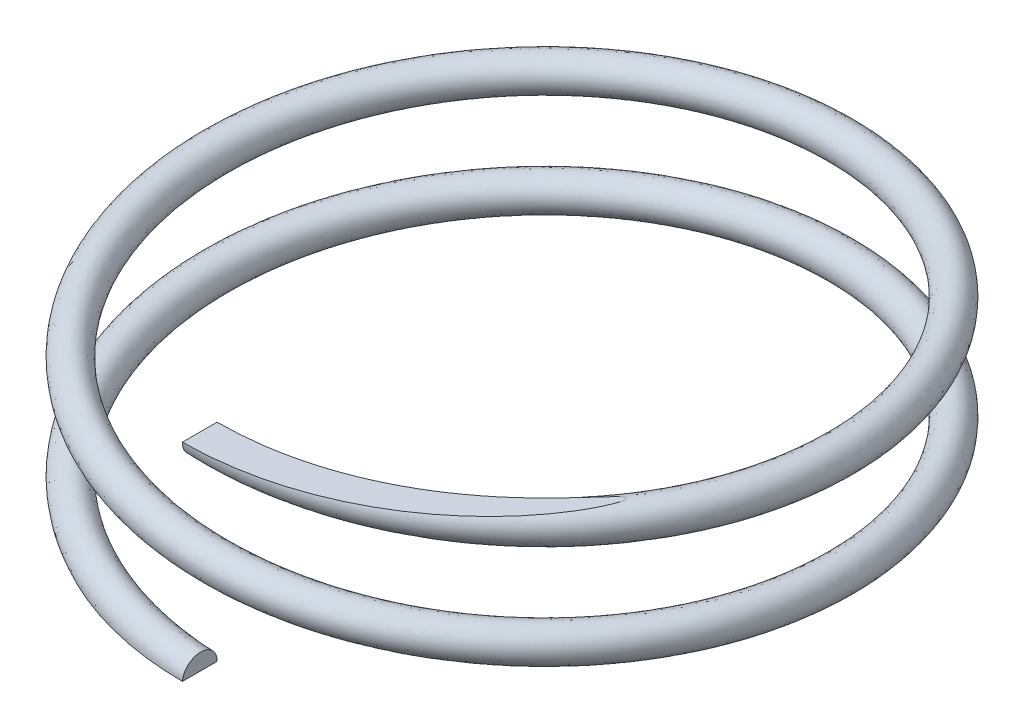
from build123d import *

# Parameters (mm, degrees)
SWEEP_1_PITCH       = 15
SWEEP_1_HEIGHT      = 30
SWEEP_1_RADIUS      = 45
SKETCH_3_R          = 2.5
SKETCH_4_W          = 134.192680268
SKETCH_4_H          = 135.515216118
CUT_EXTRUDE_1_DEPTH = 75.873418531
SKETCH_5_W          = 134.192680268
SKETCH_5_H          = 135.515216118
CUT_EXTRUDE_2_DEPTH = 75.873418531


with BuildPart() as part:
    # По траектории1: sweep along a helix
    with BuildLine() as sweep_1_path:
        Helix(SWEEP_1_PITCH, SWEEP_1_HEIGHT, SWEEP_1_RADIUS, center=(0, 0, 0), direction=(0, 1, 0), lefthand=True)
    # Эскиз3 → По траектории1 (sweep)
    with BuildSketch(Plane(origin=(0, 0, 45), x_dir=(0, 0, 1), z_dir=(-0.9985957248694318, 0.05297714858780133, 0))):
        with Locations((0.196998306, 0)):
            Circle(SKETCH_3_R)
    sweep(path=sweep_1_path.line, is_frenet=True)

    # Эскиз4 → Вырез-Вытянуть1 (cut, through all)
    with BuildSketch(Plane(origin=(0, 0, 0), x_dir=(1, 0, 0), z_dir=(0, 1, 0))):
        with Locations((3.329967917, 0)):
            Rectangle(SKETCH_4_W, SKETCH_4_H)
    extrude(amount=-CUT_EXTRUDE_1_DEPTH, mode=Mode.SUBTRACT)

    # Эскиз5 → Вырез-Вытянуть2 (cut, through all)
    with BuildSketch(Plane(origin=(0, 30, 0), x_dir=(1, 0, 0), z_dir=(0, 1, 0))):
        with Locations((3.329967917, 0)):
            Rectangle(SKETCH_5_W, SKETCH_5_H)
    extrude(amount=CUT_EXTRUDE_2_DEPTH, mode=Mode.SUBTRACT)


solid = part.part
